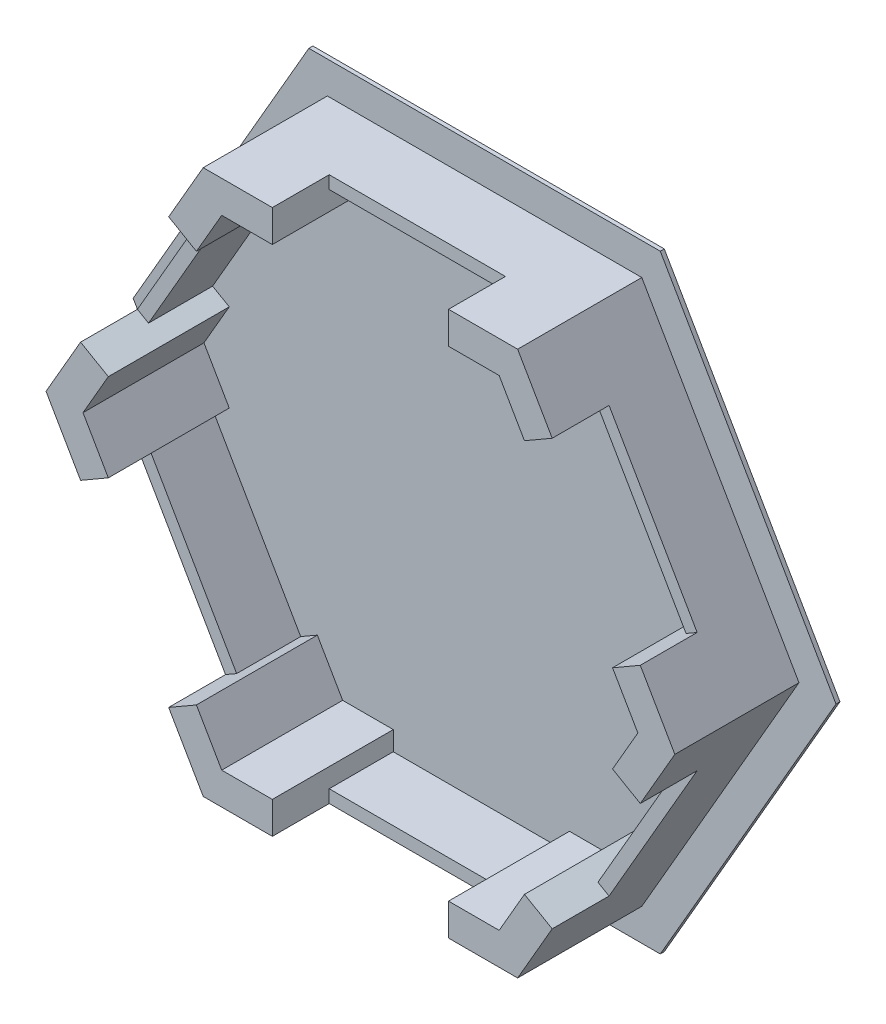
from build123d import *

# Parameters (mm, degrees)
BOSS_EXTRUDE1_DEPTH = 0.45
SKETCH2_W           = 11
SKETCH2_H           = 0.5
BOSS_EXTRUDE2_DEPTH = 0.25
BOSS_EXTRUDE3_DEPTH = 8
BOSS_EXTRUDE4_DEPTH = 0.25
SKETCH5_W           = 11
SKETCH5_H           = 0.8
BOSS_EXTRUDE5_DEPTH = 4


with BuildPart() as part:
    # Sketch1 → Boss-Extrude1 (new body)
    with BuildSketch(Plane.XY):
        Polygon((19.629909152, 0), (9.814954576, 17), (-9.814954576, 17), (-19.629909152, 0), (-9.814954576, -17), (9.814954576, -17), align=None)
    extrude(amount=BOSS_EXTRUDE1_DEPTH)

    # Sketch2 → Boss-Extrude2 (add)
    with BuildSketch(Plane.XY):
        with Locations((0, 17.25)):
            Rectangle(SKETCH2_W, SKETCH2_H)
        Polygon((12.405444566, 13.513139721), (17.905444566, 3.986860279), (17.472431864, 3.736860279), (11.972431864, 13.263139721), align=None)
        Polygon((17.905444566, -3.986860279), (12.405444566, -13.513139721), (11.972431864, -13.263139721), (17.472431864, -3.736860279), align=None)
        with Locations((0, -17.25)):
            Rectangle(SKETCH2_W, SKETCH2_H)
        Polygon((-12.405444566, -13.513139721), (-17.905444566, -3.986860279), (-17.472431864, -3.736860279), (-11.972431864, -13.263139721), align=None)
        Polygon((-17.905444566, 3.986860279), (-12.405444566, 13.513139721), (-11.972431864, 13.263139721), (-17.472431864, 3.736860279), align=None)
    extrude(amount=BOSS_EXTRUDE2_DEPTH)

    # Sketch3 → Boss-Extrude3 (add)
    with BuildSketch(Plane.XY):
        Polygon((-11.972431864, 13.263139721), (-10.240381057, 12.263139721), (-8.660254038, 15), (-5.5, 15), (-5.5, 17), (-7.5, 17), (-9.814954576, 17), (-10.972431864, 14.995190528), align=None)
        Polygon((5.5, 17), (5.5, 15), (8.660254038, 15), (10.240381057, 12.263139721), (11.972431864, 13.263139721), (10.972431864, 14.995190528), (9.814954576, 17), (7.5, 17), align=None)
        Polygon((17.472431864, 3.736860279), (15.740381057, 2.736860279), (17.320508076, 0), (15.740381057, -2.736860279), (17.472431864, -3.736860279), (18.472431864, -2.004809472), (19.629909152, 0), (18.472431864, 2.004809472), align=None)
        Polygon((11.972431864, -13.263139721), (10.240381057, -12.263139721), (8.660254038, -15), (5.5, -15), (5.5, -17), (7.5, -17), (9.814954576, -17), (10.972431864, -14.995190528), align=None)
        Polygon((-5.5, -17), (-5.5, -15), (-8.660254038, -15), (-10.240381057, -12.263139721), (-11.972431864, -13.263139721), (-10.972431864, -14.995190528), (-9.814954576, -17), (-7.5, -17), align=None)
        Polygon((-17.472431864, -3.736860279), (-15.740381057, -2.736860279), (-17.320508076, 0), (-15.740381057, 2.736860279), (-17.472431864, 3.736860279), (-18.472431864, 2.004809472), (-19.629909152, 0), (-18.472431864, -2.004809472), align=None)
    extrude(amount=BOSS_EXTRUDE3_DEPTH)

    # Sketch4 → Boss-Extrude4 (add)
    with BuildSketch(Plane.XY):
        Polygon((21.939310229, 0), (10.969655115, 19), (-10.969655115, 19), (-21.939310229, 0), (-10.969655115, -19), (10.969655115, -19), align=None)
    extrude(amount=BOSS_EXTRUDE4_DEPTH)

    # Sketch5 → Boss-Extrude5 (add)
    with BuildSketch(Plane.XY.offset(0.45)):
        with Locations((0, 16.6)):
            Rectangle(SKETCH5_W, SKETCH5_H)
        Polygon((11.972431864, 13.263139721), (17.472431864, 3.736860279), (16.779611541, 3.336860279), (11.279611541, 12.863139721), align=None)
        Polygon((17.472431864, -3.736860279), (11.972431864, -13.263139721), (11.279611541, -12.863139721), (16.779611541, -3.336860279), align=None)
        with Locations((0, -16.6)):
            Rectangle(SKETCH5_W, SKETCH5_H)
        Polygon((-11.972431864, -13.263139721), (-17.472431864, -3.736860279), (-16.779611541, -3.336860279), (-11.279611541, -12.863139721), align=None)
        Polygon((-17.472431864, 3.736860279), (-11.972431864, 13.263139721), (-11.279611541, 12.863139721), (-16.779611541, 3.336860279), align=None)
    extrude(amount=BOSS_EXTRUDE5_DEPTH)


solid = part.part
